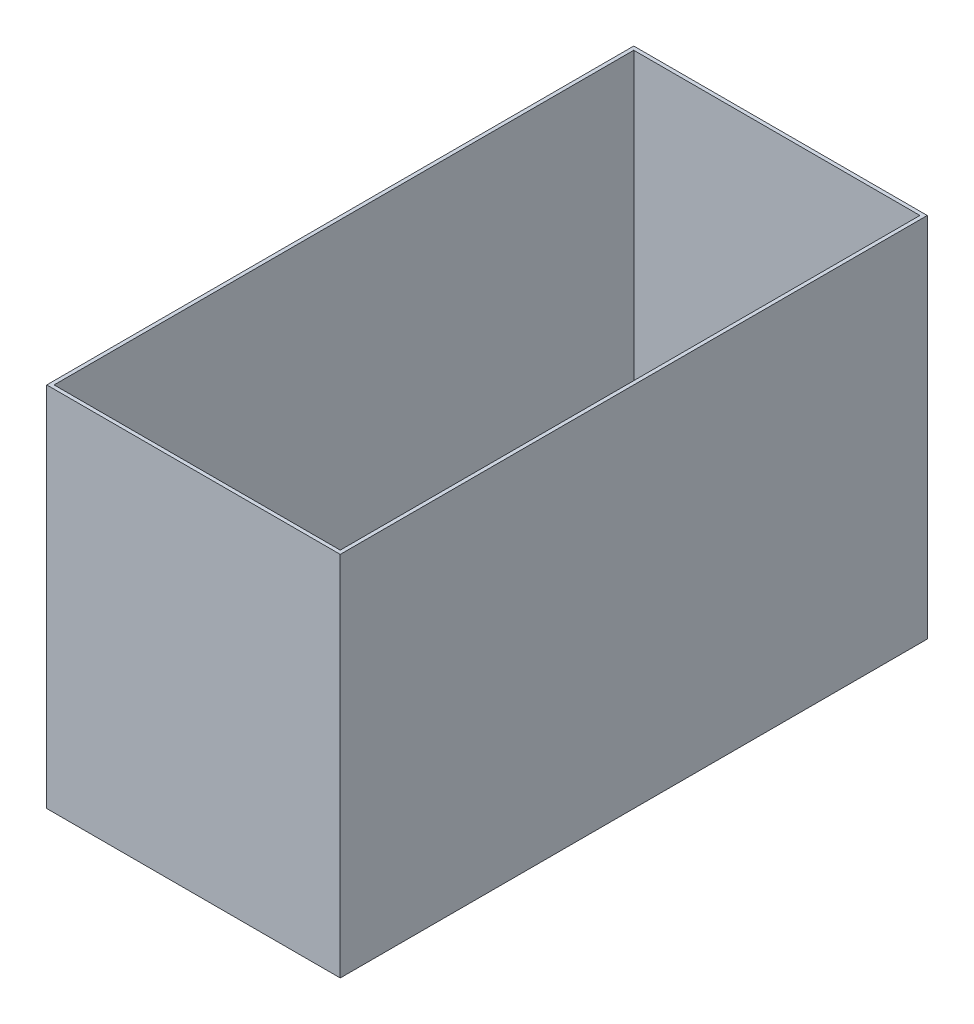
from build123d import *

# Parameters (mm, degrees)
SKETCH1_W           = 203.2
SKETCH1_H           = 406.4
BOSS_EXTRUDE1_DEPTH = 254
SHELL1_T            = -2.54


with BuildPart() as part:
    # Sketch1 → Boss-Extrude1 (new body)
    with BuildSketch(Plane(origin=(0, 0, 0), x_dir=(1, 0, 0), z_dir=(0, 1, 0))):
        Rectangle(SKETCH1_W, SKETCH1_H)
    extrude(amount=BOSS_EXTRUDE1_DEPTH)

    # Shell1
    shell1_openings = [part.faces().sort_by_distance(p)[0] for p in [
        (0, 254, 0),
    ]]
    offset(amount=SHELL1_T, openings=shell1_openings, kind=Kind.INTERSECTION)


solid = part.part
